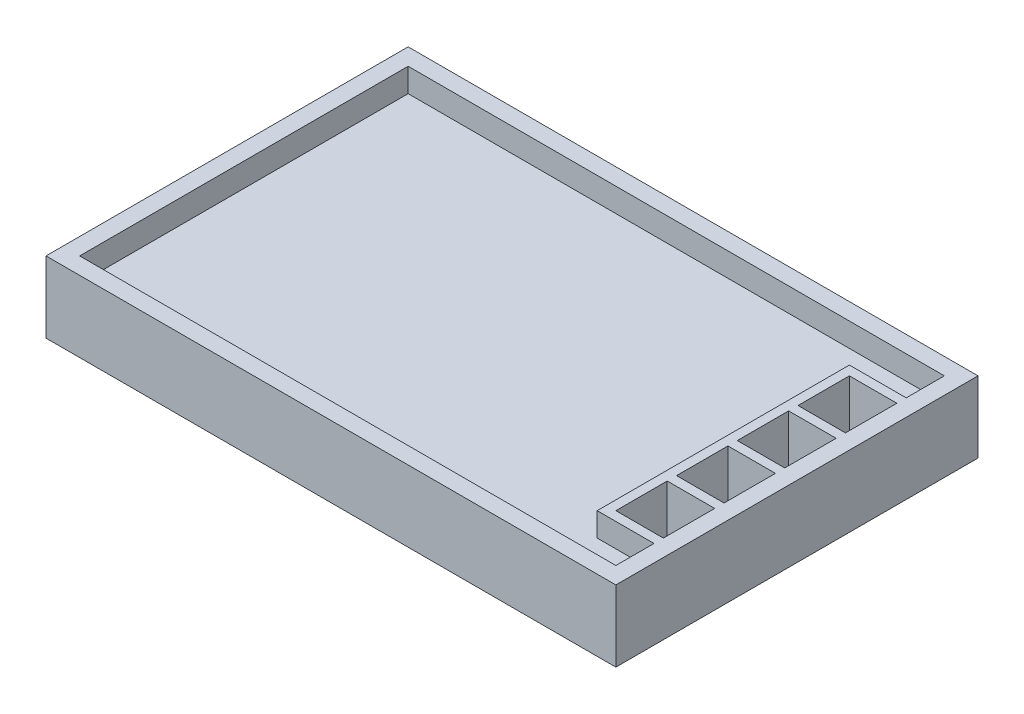
from build123d import *

# Parameters (mm, degrees)
SKETCH1_W           = 609.6
SKETCH1_H           = 387.4
BOSS_EXTRUDE1_DEPTH = 76.2
SKETCH2_W           = 573.6
SKETCH2_H           = 351.4
CUT_EXTRUDE1_DEPTH  = 25.4
SKETCH3_W           = 50.8
SKETCH3_H           = 54.95
CUT_EXTRUDE2_DEPTH  = 35.8
BOSS_EXTRUDE2_DEPTH = 25.4


with BuildPart() as part:
    # Sketch1 → Boss-Extrude1 (new body)
    with BuildSketch(Plane(origin=(0, 0, 0), x_dir=(1, 0, 0), z_dir=(0, 1, 0))):
        with Locations((32.357180973, 74.716472916)):
            Rectangle(SKETCH1_W, SKETCH1_H)
    extrude(amount=-BOSS_EXTRUDE1_DEPTH)

    # Sketch2 → Cut-Extrude1 (cut)
    with BuildSketch(Plane(origin=(0, 0, 0), x_dir=(1, 0, 0), z_dir=(0, 1, 0))):
        with Locations((32.357180973, 74.716472916)):
            Rectangle(SKETCH2_W, SKETCH2_H)
    extrude(amount=-CUT_EXTRUDE1_DEPTH, mode=Mode.SUBTRACT)

    # Sketch3 → Cut-Extrude2 (cut)
    with BuildSketch(Plane(origin=(0, -25.4, 0), x_dir=(1, 0, 0), z_dir=(0, 1, 0))):
        with Locations((293.757180973, 172.141472916)):
            Rectangle(SKETCH3_W, SKETCH3_H)
        with Locations((293.757180973, 107.191472916)):
            Rectangle(SKETCH3_W, SKETCH3_H)
        with Locations((293.757180973, 42.241472916)):
            Rectangle(SKETCH3_W, SKETCH3_H)
        with Locations((293.757180973, -22.708527084)):
            Rectangle(SKETCH3_W, SKETCH3_H)
    extrude(amount=-CUT_EXTRUDE2_DEPTH, mode=Mode.SUBTRACT)

    # Sketch7 → Boss-Extrude2 (add)
    with BuildSketch(Plane(origin=(0, -25.4, 0), x_dir=(1, 0, 0), z_dir=(0, 1, 0))):
        Polygon((319.157180973, 209.616472916), (258.357180973, 209.616472916), (258.357180973, -60.183527084), (319.157180973, -60.183527084), (319.157180973, -50.183527084), (268.357180973, -50.183527084), (268.357180973, 4.766472916), (319.157180973, 4.766472916), (319.157180973, 14.766472916), (268.357180973, 14.766472916), (268.357180973, 69.716472916), (319.157180973, 69.716472916), (319.157180973, 79.716472916), (268.357180973, 79.716472916), (268.357180973, 134.666472916), (319.157180973, 134.666472916), (319.157180973, 144.666472916), (268.357180973, 144.666472916), (268.357180973, 199.616472916), (319.157180973, 199.616472916), align=None)
    extrude(amount=BOSS_EXTRUDE2_DEPTH)


solid = part.part
